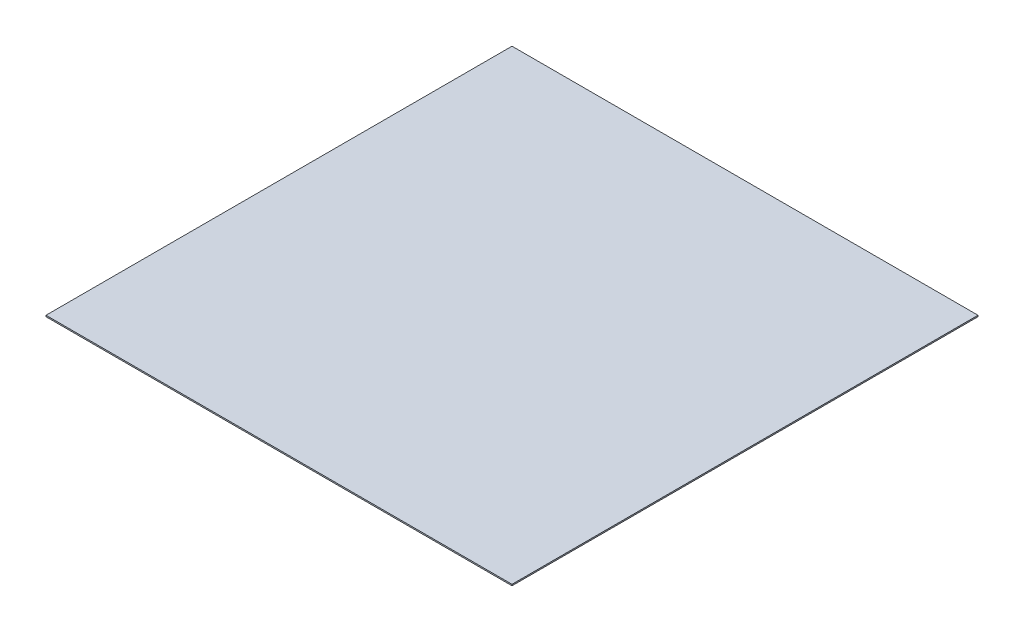
from build123d import *

# Parameters (mm, degrees)
SKETCH1_W           = 3500
SKETCH1_H           = 3500
BOSS_EXTRUDE1_DEPTH = 10


with BuildPart() as part:
    # Sketch1 → Boss-Extrude1 (new body)
    with BuildSketch(Plane(origin=(0, 0, 0), x_dir=(1, 0, 0), z_dir=(0, 1, 0))):
        Rectangle(SKETCH1_W, SKETCH1_H)
    extrude(amount=BOSS_EXTRUDE1_DEPTH)


solid = part.part
